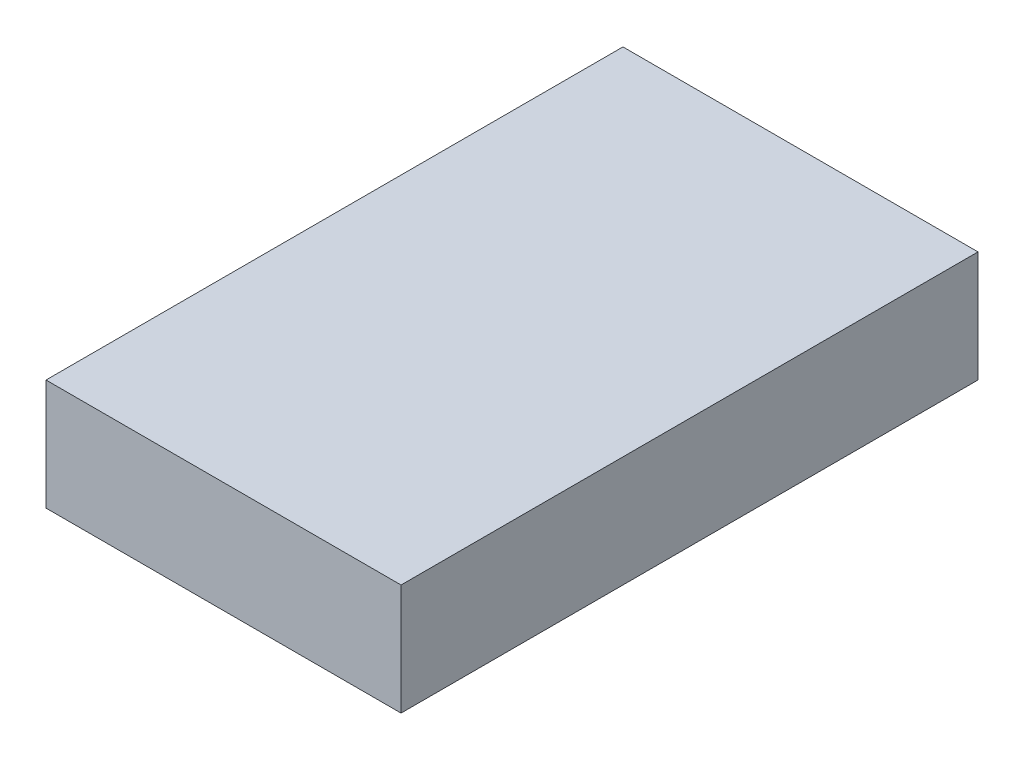
from build123d import *

# Parameters (mm, degrees)
SKETCH_1_W      = 16
SKETCH_1_H      = 26
EXTRUDE_1_DEPTH = 5


with BuildPart() as part:
    # 스케치1 → 보스-돌출1 (new body)
    with BuildSketch(Plane(origin=(0, 0, 0), x_dir=(1, 0, 0), z_dir=(0, 1, 0))):
        Rectangle(SKETCH_1_W, SKETCH_1_H)
    extrude(amount=EXTRUDE_1_DEPTH)


solid = part.part
